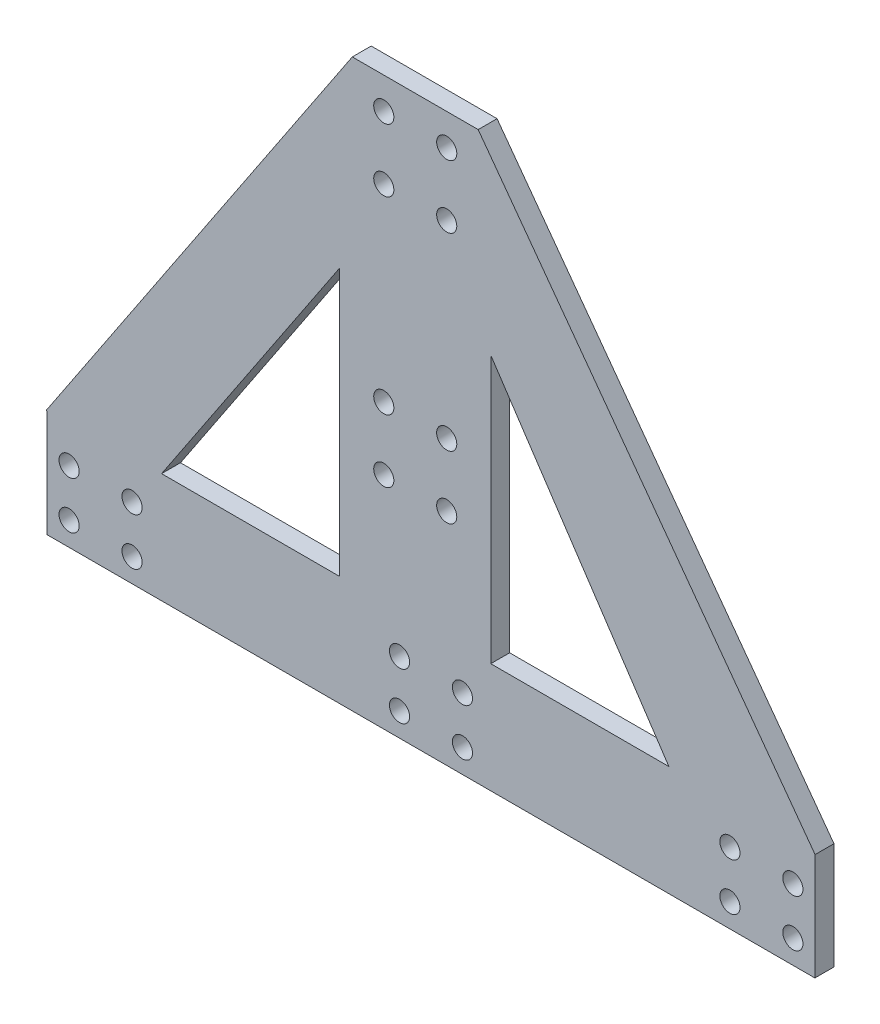
from build123d import *

# Parameters (mm, degrees)
EXTRUDE_1_DEPTH     = 3
SKETCH_2_R          = 1.6
SKETCH_2_W          = 1.5
SKETCH_2_H          = 17
CUT_EXTRUDE_1_DEPTH = 118.192149908


with BuildPart() as part:
    # 草图1 → 凸台-拉伸1 (new body)
    with BuildSketch(Plane.XY):
        Polygon((0, 0), (20, 0), (75, -75), (75, -90), (-50, -90), (-50, -75), align=None)
    extrude(amount=EXTRUDE_1_DEPTH)

    # 草图2 → 切除-拉伸1 (cut, through all)
    with BuildSketch(Plane.XY.offset(3)):
        with Locations((5, -5)):
            Circle(SKETCH_2_R)
        with Locations(Location((15, -5, 0), (0, 0, 180))):
            Circle(SKETCH_2_R)
        with Locations((15, -15)):
            Circle(SKETCH_2_R)
        with Locations(Location((5, -15, 0), (0, 0, 180))):
            Circle(SKETCH_2_R)
        with Locations((-45, -86.25)):
            Circle(SKETCH_2_R)
        with Locations(Location((-45, -78.75, 0), (0, 0, 180))):
            Circle(SKETCH_2_R)
        with Locations(Location((-35, -86.25, 0), (0, 0, 180))):
            Circle(SKETCH_2_R)
        with Locations((-35, -78.75)):
            Circle(SKETCH_2_R)
        with Locations(Location((60, -78.75, 0), (0, 0, 180))):
            Circle(SKETCH_2_R)
        with Locations((60, -86.25)):
            Circle(SKETCH_2_R)
        with Locations((70, -78.75)):
            Circle(SKETCH_2_R)
        with Locations(Location((70, -86.25, 0), (0, 0, 180))):
            Circle(SKETCH_2_R)
        with Locations((7.5, -86.25)):
            Circle(SKETCH_2_R)
        with Locations(Location((17.5, -86.25, 0), (0, 0, 180))):
            Circle(SKETCH_2_R)
        with Locations((17.5, -78.75)):
            Circle(SKETCH_2_R)
        with Locations(Location((7.5, -78.75, 0), (0, 0, 180))):
            Circle(SKETCH_2_R)
        with Locations((5, -45)):
            Circle(SKETCH_2_R)
        with Locations(Location((15, -45, 0), (0, 0, 180))):
            Circle(SKETCH_2_R)
        with Locations((15, -55)):
            Circle(SKETCH_2_R)
        with Locations(Location((5, -55, 0), (0, 0, 180))):
            Circle(SKETCH_2_R)
        Polygon((-2, -30.041634566), (-2, -72.5), (-30.305576956, -72.5), align=None)
        Polygon((22, -72.5), (50.305576956, -72.5), (22, -30.041634566), align=None)
        with Locations((74.25, -81.5)):
            Rectangle(SKETCH_2_W, SKETCH_2_H)
        with Locations((-49.25, -81.5)):
            Rectangle(SKETCH_2_W, SKETCH_2_H)
    extrude(amount=-CUT_EXTRUDE_1_DEPTH, mode=Mode.SUBTRACT)


solid = part.part
